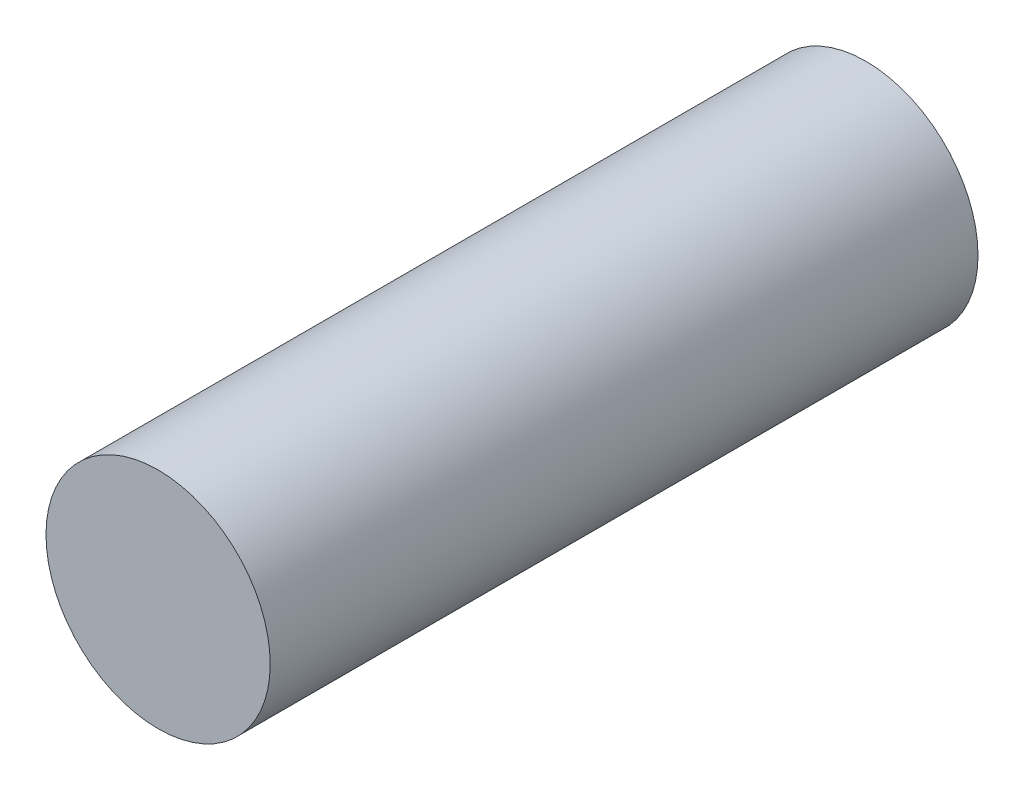
from build123d import *

# Parameters (mm, degrees)
SKETCH1_R      = 8.89
EXTRUDE1_DEPTH = 56.134


with BuildPart() as part:
    # Sketch1 → Extrude1 (new body)
    with BuildSketch(Plane.XY):
        with Locations((81.443110483, -68.468113052)):
            Circle(SKETCH1_R)
    extrude(amount=EXTRUDE1_DEPTH)


solid = part.part
